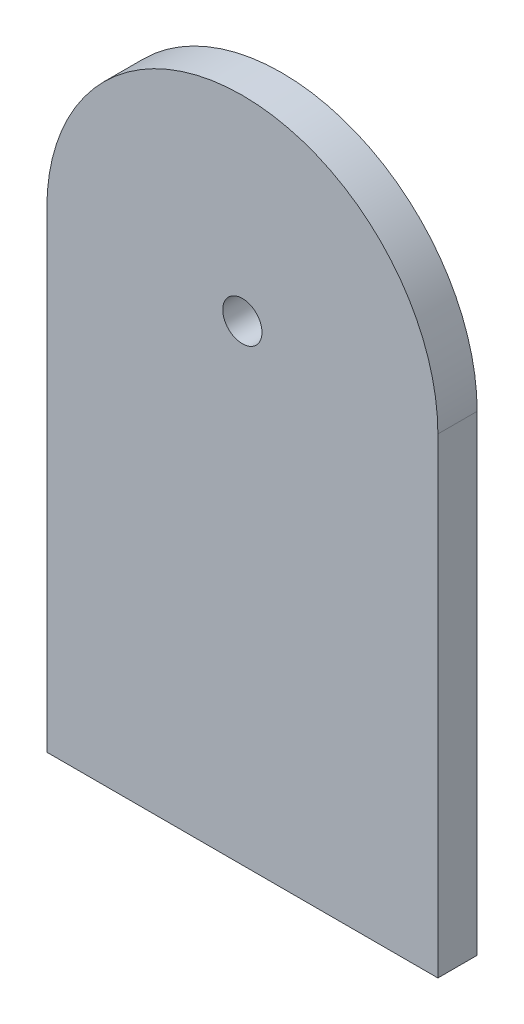
from build123d import *

# Parameters (mm, degrees)
BOSS_EXTRUDE1_DEPTH = 5
SKETCH2_R           = 2.5
CUT_EXTRUDE1_DEPTH  = 50


with BuildPart() as part:
    # Sketch1 → Boss-Extrude1 (new body)
    with BuildSketch(Plane.XY):
        with BuildLine():
            ThreePointArc((24.9, 60), (0, 84.9), (-24.9, 60))
            Line((-24.9, 60), (24.9, 60))
        make_face()
        with BuildLine():
            Line((24.9, 60), (-24.9, 60))
            ThreePointArc((-24.9, 60), (0, 35.1), (24.9, 60))
        make_face()
        with BuildLine():
            Line((-24.9, 60), (-24.9, 0))
            Line((-24.9, 0), (24.9, 0))
            Line((24.9, 0), (24.9, 60))
            ThreePointArc((24.9, 60), (0, 35.1), (-24.9, 60))
        make_face()
    extrude(amount=-BOSS_EXTRUDE1_DEPTH)

    # Sketch2 → Cut-Extrude1 (cut)
    with BuildSketch(Plane.XY):
        with Locations((0, 60)):
            Circle(SKETCH2_R)
    extrude(amount=-CUT_EXTRUDE1_DEPTH, mode=Mode.SUBTRACT)


solid = part.part
